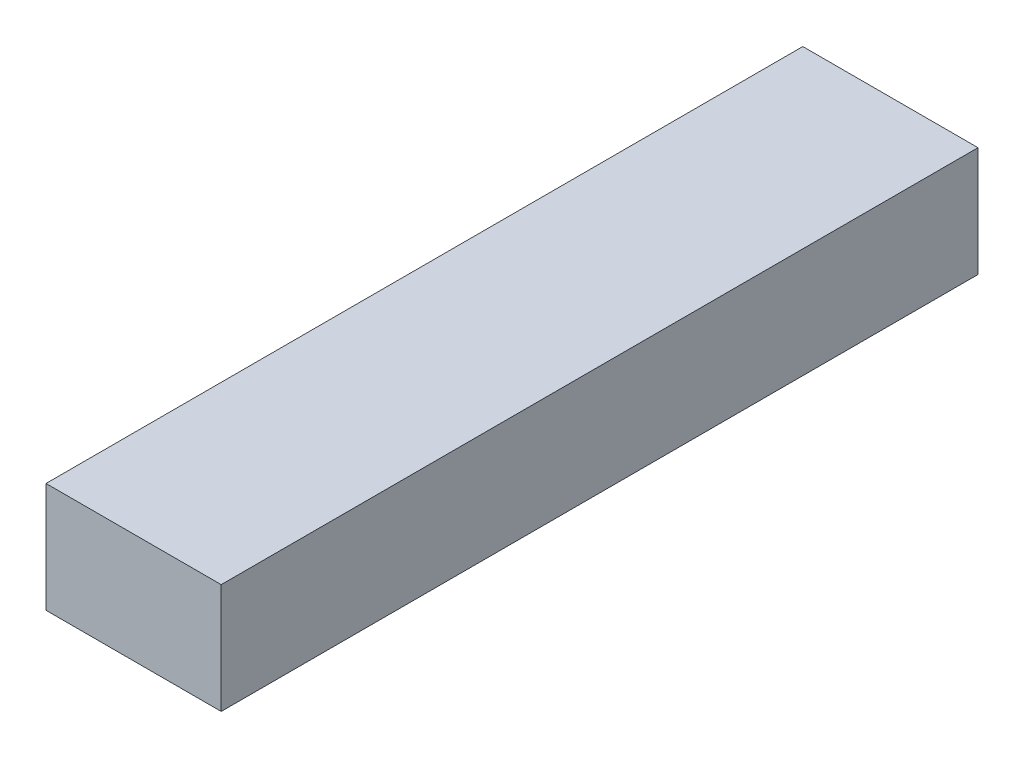
from build123d import *

# Parameters (mm, degrees)
SKETCH113_W         = 38874.836
SKETCH113_H         = 5643
BOSS_EXTRUDE1_DEPTH = 4499.999999982


with BuildPart() as part:
    # Sketch113 → Boss-Extrude1 (new, symmetric)
    with BuildSketch(Plane(origin=(0, 0, 0), x_dir=(0, 0, -1), z_dir=(1, 0, 0))):
        with Locations((11780.957, 2821.5)):
            Rectangle(SKETCH113_W, SKETCH113_H)
    extrude(amount=BOSS_EXTRUDE1_DEPTH, both=True)


solid = part.part
